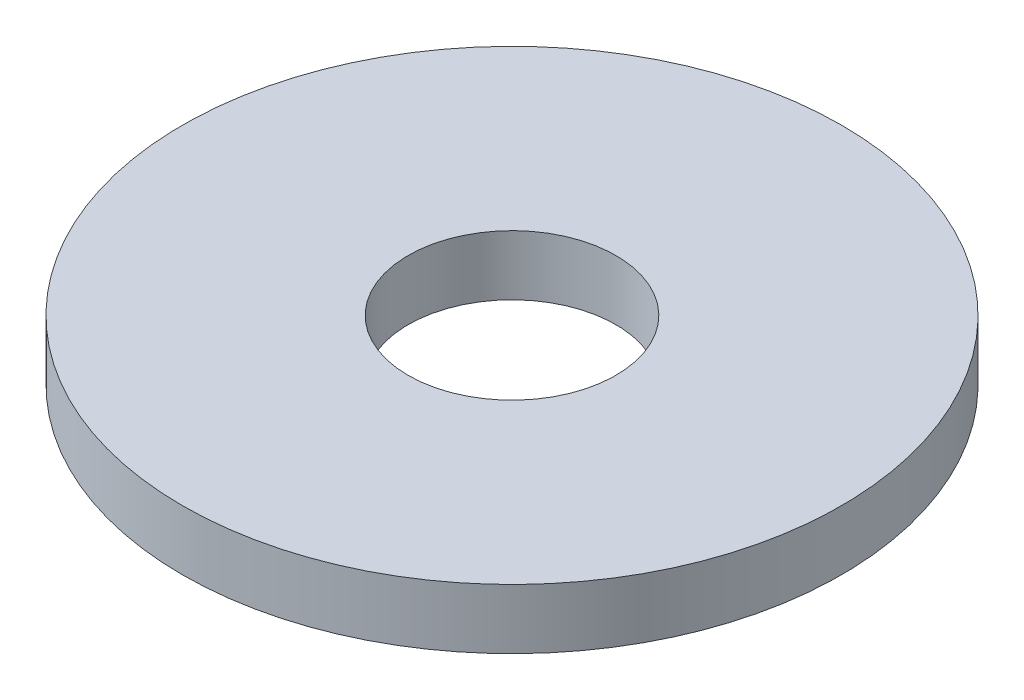
from build123d import *

# Parameters (mm, degrees)
SKETCH1_R   = 8.25
SKETCH1_R_2 = 2.6
BODY_DEPTH  = 1.5


with BuildPart() as part:
    # Sketch1 → body (new body)
    with BuildSketch(Plane(origin=(0, 0, 0), x_dir=(1, 0, 0), z_dir=(0, 1, 0))):
        with Locations(Location((0, 0, 0), (0, 0, 270))):
            Circle(SKETCH1_R)
        with Locations(Location((0, 0, 0), (0, 0, 270))):
            Circle(SKETCH1_R_2, mode=Mode.SUBTRACT)
    extrude(amount=BODY_DEPTH)


solid = part.part
